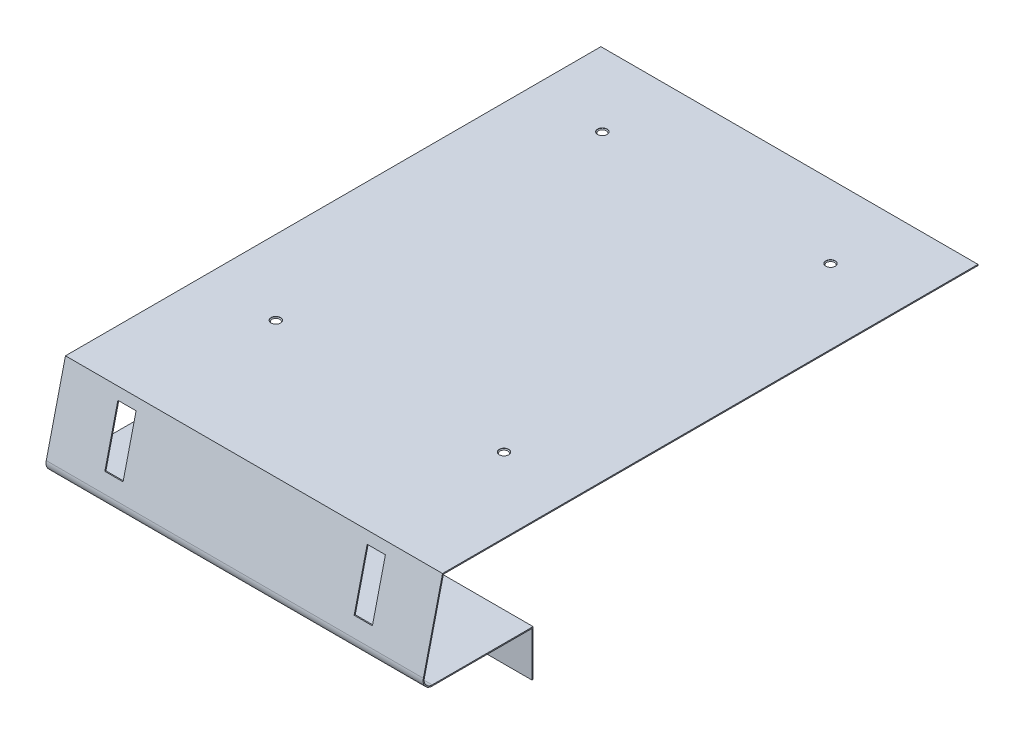
from build123d import *

# Parameters (mm, degrees)
SKETCH_1_W                  = 413.2
SKETCH_1_H                  = 588.12
EXTRUDE_1_DEPTH             = 1.2
CUT_EXTRUDE_1_DEPTH         = 360.383198828
CUT_EXTRUDE_1_DEPTH_BACK    = 360.383198828
EXTRUDE_3_DEPTH             = 413.2
CUT_EXTRUDE_2_REACH         = 407.539
SKETCH_5_W                  = 413.2
SKETCH_5_H                  = 1
HOLE_WIZARD_M5_1_AT_2_COUNT = 2
HOLE_WIZARD_M5_1_AT_2_PITCH = 250
HOLE_WIZARD_M5_1_AT_3_COUNT = 2
HOLE_WIZARD_M5_1_AT_3_PITCH = 436.48692993
HOLE_WIZARD_M5_1_AT_4_COUNT = 2
HOLE_WIZARD_M5_1_AT_4_PITCH = 357.8
CUT_EXTRUDE_3_REACH         = 553.095
SKETCH_10_W                 = 80
SKETCH_10_H                 = 49
CUT_EXTRUDE_4_REACH         = 665.873
SKETCH_11_W                 = 20
SKETCH_11_H                 = 60
CUT_EXTRUDE_5_DEPTH         = 20


with BuildPart() as part:
    # 스케치1 → 보스-돌출1 (new body)
    with BuildSketch(Plane(origin=(0, 0, 0), x_dir=(1, 0, 0), z_dir=(0, 1, 0))):
        Rectangle(SKETCH_1_W, SKETCH_1_H)
    extrude(amount=EXTRUDE_1_DEPTH)

    # 스케치2 → 컷-돌출1 (cut, two sides: drawn at the far end of the back side and taken through both)
    with BuildSketch(Plane(origin=(0, 0, 0), x_dir=(0, 0, -1), z_dir=(1, 0, 0)).offset(-CUT_EXTRUDE_1_DEPTH_BACK)):
        Polygon((-293.957235481, 0), (-293.673125179, 1.2), (-294.06, 1.2), (-294.06, 0), align=None)
    extrude(amount=CUT_EXTRUDE_1_DEPTH + CUT_EXTRUDE_1_DEPTH_BACK, mode=Mode.SUBTRACT)

    # 스케치4 → 보스-돌출3 (add)
    with BuildSketch(Plane(origin=(206.6, 0, 0), x_dir=(0, 0, -1), z_dir=(1, 0, 0))):
        with BuildLine():
            Line((-293.957235481, 0), (-314.720041398, -87.696105733))
            ThreePointArc((-314.720041398, -87.696105733), (-312.832491208, -96.20326758), (-304.989056289, -100))
            Line((-304.989056289, -100), (-195.633093997, -100))
            Line((-195.633093997, -100), (-195.633093997, -149))
            Line((-195.633093997, -149), (-194.433093997, -149))
            Line((-194.433093997, -149), (-194.433093997, -98.8))
            Line((-194.433093997, -98.8), (-304.989056289, -98.8))
            ThreePointArc((-304.989056289, -98.8), (-311.891279018, -95.45887547), (-313.552323185, -87.972573045))
            Line((-313.552323185, -87.972573045), (-292.789517268, -0.276467312))
            Line((-292.789517268, -0.276467312), (-292.724061259, 0))
            Line((-292.724061259, 0), (-293.957235481, 0))
        make_face()
    extrude(amount=-EXTRUDE_3_DEPTH)

    # 스케치5 → 컷-돌출2 (cut, up to next)
    with BuildSketch(Plane(origin=(0, 1.2, 0), x_dir=(1, 0, 0), z_dir=(0, 1, 0)), mode=Mode.PRIVATE) as cut_extrude_2_sk1:
        with Locations((0, 293.56)):
            Rectangle(SKETCH_5_W, SKETCH_5_H)
    cut_extrude_2_tool1 = extrude(cut_extrude_2_sk1.sketch, amount=-CUT_EXTRUDE_2_REACH, mode=Mode.PRIVATE) & part.part
    add(cut_extrude_2_tool1.solids().sort_by_distance((0, 1.2, -293.56))[0], mode=Mode.SUBTRACT)

    # 스케치8 → M5 접시 머리 나사용 카운터싱크1 (revolve, cut)
    with BuildSketch(Plane(origin=(-125, 1.2, -213.06), x_dir=(0, 0, 1), z_dir=(1, 0, 0))):
        Polygon((0, 0), (0, 1.2), (2.75, 1.2), (2.75, 2.75), (5.2, 0.3), (5.2, 0), align=None)
    hole_wizard_m5_1 = revolve(axis=Axis((-125, 7.55, -213.06), (0, -1, 0)), mode=Mode.SUBTRACT)

    # M5 접시 머리 나사용 카운터싱크1 at 2: M5 접시 머리 나사용 카운터싱크1 ×2
    with Locations(*[(i * HOLE_WIZARD_M5_1_AT_2_PITCH, 0, 0) for i in range(1, HOLE_WIZARD_M5_1_AT_2_COUNT)]):
        add(hole_wizard_m5_1, mode=Mode.SUBTRACT)

    # M5 접시 머리 나사용 카운터싱크1 at 3: M5 접시 머리 나사용 카운터싱크1 ×2
    with Locations(*[Vector(0.5727548360724275, 0, 0.8197267213868575) * (i * HOLE_WIZARD_M5_1_AT_3_PITCH) for i in range(1, HOLE_WIZARD_M5_1_AT_3_COUNT)]):
        add(hole_wizard_m5_1, mode=Mode.SUBTRACT)

    # M5 접시 머리 나사용 카운터싱크1 at 4: M5 접시 머리 나사용 카운터싱크1 ×2
    with Locations(*[(0, 0, i * HOLE_WIZARD_M5_1_AT_4_PITCH) for i in range(1, HOLE_WIZARD_M5_1_AT_4_COUNT)]):
        add(hole_wizard_m5_1, mode=Mode.SUBTRACT)

    # 스케치10 → 컷-돌출3 (cut, up to next)
    with BuildSketch(Plane.XY.offset(195.633093997), mode=Mode.PRIVATE) as cut_extrude_3_sk1:
        with Locations((0, -124.5)):
            Rectangle(SKETCH_10_W, SKETCH_10_H)
    cut_extrude_3_tool1 = extrude(cut_extrude_3_sk1.sketch, amount=-CUT_EXTRUDE_3_REACH, mode=Mode.PRIVATE) & part.part
    add(cut_extrude_3_tool1.solids().sort_by_distance((0, -124.5, 195.633094))[0], mode=Mode.SUBTRACT)

    # 컷-돌출4: up to this plane
    cut_extrude_4_end = Plane(origin=(-206.6, -0.276467312, 292.789517268), z_dir=(0, -0.2303894266765572, -0.9730985109821345))
    # 스케치11 → 컷-돌출4 (cut, up to the surface)
    with BuildSketch(Plane.XY.offset(320), mode=Mode.PRIVATE) as cut_extrude_4_sk1:
        with Locations((-136.6, -40)):
            Rectangle(SKETCH_11_W, SKETCH_11_H)
    cut_extrude_4_tool1 = split(extrude(cut_extrude_4_sk1.sketch, amount=-CUT_EXTRUDE_4_REACH, mode=Mode.PRIVATE), bisect_by=cut_extrude_4_end, keep=Keep.BOTH, mode=Mode.PRIVATE)
    add(cut_extrude_4_tool1.solids().sort_by_distance((-136.6, -40, 320))[0], mode=Mode.SUBTRACT)
    # 스케치11 → 컷-돌출4 (cut, up to the surface)
    with BuildSketch(Plane.XY.offset(320), mode=Mode.PRIVATE) as cut_extrude_4_sk2:
        with Locations((136.6, -40)):
            Rectangle(SKETCH_11_W, SKETCH_11_H)
    cut_extrude_4_tool2 = split(extrude(cut_extrude_4_sk2.sketch, amount=-CUT_EXTRUDE_4_REACH, mode=Mode.PRIVATE), bisect_by=cut_extrude_4_end, keep=Keep.BOTH, mode=Mode.PRIVATE)
    add(cut_extrude_4_tool2.solids().sort_by_distance((136.6, -40, 320))[0], mode=Mode.SUBTRACT)

    # 스케치12 → 컷-돌출5 (cut)
    with BuildSketch(Plane(origin=(-146.6, 0, 0), x_dir=(0, 0, -1), z_dir=(1, 0, 0))):
        Polygon((-295.09164711, -10), (-296.259365323, -9.723532688), (-296.324821333, -10), (-310.530336442, -70), (-309.316935211, -70.083515414), (-309.297162219, -70), align=None)
    cut_extrude_5 = extrude(amount=CUT_EXTRUDE_5_DEPTH, mode=Mode.SUBTRACT)

    # 대칭 복사2: 컷-돌출5 across plane
    add(cut_extrude_5.mirror(Plane(origin=(0, 0, 0), x_dir=(0, 0, 1), z_dir=(1, 0, 0))), mode=Mode.SUBTRACT)


solid = part.part
